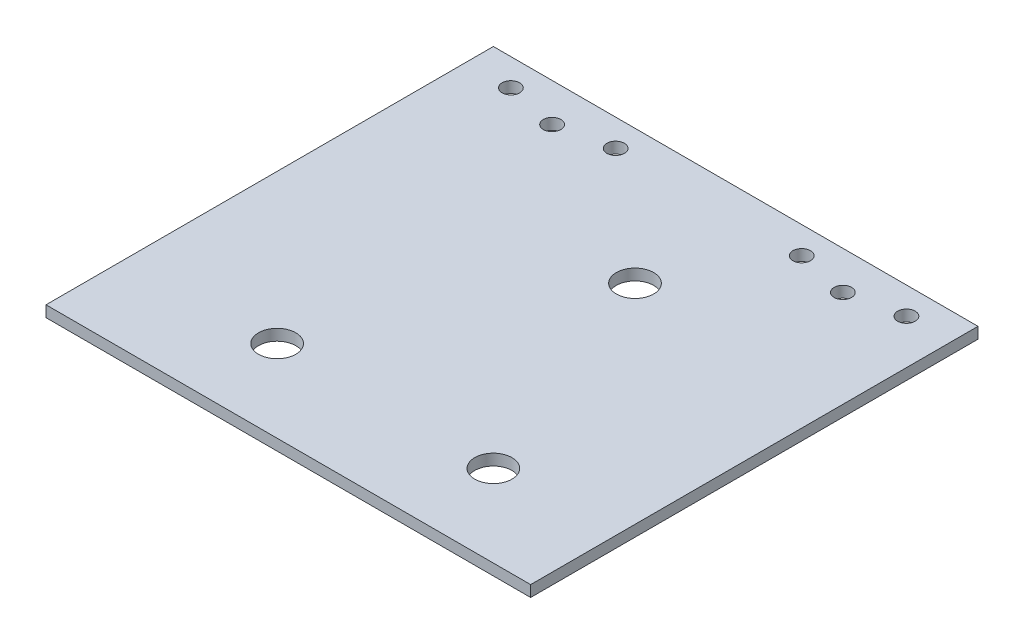
from build123d import *

# Parameters (mm, degrees)
SKETCH1_W                  = 130
SKETCH1_H                  = 150
BOSS_EXTRUDE1_DEPTH        = 3
F_10_0_10_DIAMETER_HOLE2_D = 10
F_14_0_14_DIAMETER_HOLE1_D = 14
F_5_0_5_DIAMETER_HOLE1_D   = 5
F_9_0_9_DIAMETER_HOLE1_D   = 9
F_5_0_5_DIAMETER_HOLE2_D   = 5
SKETCH15_W                 = 130
SKETCH15_H                 = 30
CUT_EXTRUDE1_DEPTH         = 199.517001791
SKETCH16_R                 = 2.35
CUT_EXTRUDE2_DEPTH         = 199.517001791


with BuildPart() as part:
    # Sketch1 → Boss-Extrude1 (new body)
    with BuildSketch(Plane(origin=(0, 0, 0), x_dir=(1, 0, 0), z_dir=(0, 1, 0))):
        with Locations((65, -75)):
            Rectangle(SKETCH1_W, SKETCH1_H)
    extrude(amount=BOSS_EXTRUDE1_DEPTH)

    # Ø10.0 (10) Diameter Hole2 (through all)
    with Locations(Plane(origin=(0, 3, 0), x_dir=(1, 0, 0), z_dir=(0, 1, 0))):
        with Locations((40, -128), (98, -128), (74, -66)):
            Hole(F_10_0_10_DIAMETER_HOLE2_D / 2)

    # Ø14.0 (14) Diameter Hole1 (through all)
    with Locations(Plane(origin=(0, 3, 0), x_dir=(1, 0, 0), z_dir=(0, 1, 0))):
        with Locations((16, -16), (114, -16)):
            Hole(F_14_0_14_DIAMETER_HOLE1_D / 2)

    # Ø5.0 (5) Diameter Hole1 (through all)
    with Locations(Plane(origin=(0, 3, 0), x_dir=(1, 0, 0), z_dir=(0, 1, 0))):
        with Locations((4.686291501, -27.313708499), (4.686291501, -4.686291501), (27.313708499, -4.686291501), (27.313708499, -27.313708499), (102.686291501, -27.313708499), (125.313708499, -27.313708499), (125.313708499, -4.686291501), (102.686291501, -4.686291501)):
            Hole(F_5_0_5_DIAMETER_HOLE1_D / 2)

    # Ø9.0 (9) Diameter Hole1 (through all)
    with Locations(Plane(origin=(0, 3, 0), x_dir=(1, 0, 0), z_dir=(0, 1, 0))):
        with Locations((65, -16)):
            Hole(F_9_0_9_DIAMETER_HOLE1_D / 2)

    # Ø5.0 (5) Diameter Hole2 (through all)
    with Locations(Plane(origin=(0, 3, 0), x_dir=(1, 0, 0), z_dir=(0, 1, 0))):
        with Locations((53.686291501, -27.313708499), (76.313708499, -27.313708499), (76.313708499, -4.686291501), (53.686291501, -4.686291501)):
            Hole(F_5_0_5_DIAMETER_HOLE2_D / 2)

    # Sketch15 → Cut-Extrude1 (cut, through all)
    with BuildSketch(Plane(origin=(0, 0, 0), x_dir=(1, 0, 0), z_dir=(0, 1, 0))):
        with Locations((65, -15)):
            Rectangle(SKETCH15_W, SKETCH15_H)
    extrude(amount=CUT_EXTRUDE1_DEPTH, mode=Mode.SUBTRACT)

    # Sketch16 → Cut-Extrude2 (cut, through all)
    with BuildSketch(Plane(origin=(0, 0, 0), x_dir=(1, 0, 0), z_dir=(0, 1, 0))):
        with Locations(Location((89.95, -37.25, 0), (0, 0, 90))):
            Circle(SKETCH16_R)
        with Locations(Location((118.05, -37.25, 0), (0, 0, 90))):
            Circle(SKETCH16_R)
        with Locations(Location((104, -40.25, 0), (0, 0, 90))):
            Circle(SKETCH16_R)
        with Locations(Location((11.95, -37.25, 0), (0, 0, 90))):
            Circle(SKETCH16_R)
        with Locations(Location((40.05, -37.25, 0), (0, 0, 90))):
            Circle(SKETCH16_R)
        with Locations(Location((26, -40.25, 0), (0, 0, 90))):
            Circle(SKETCH16_R)
    extrude(amount=CUT_EXTRUDE2_DEPTH, mode=Mode.SUBTRACT)


solid = part.part
